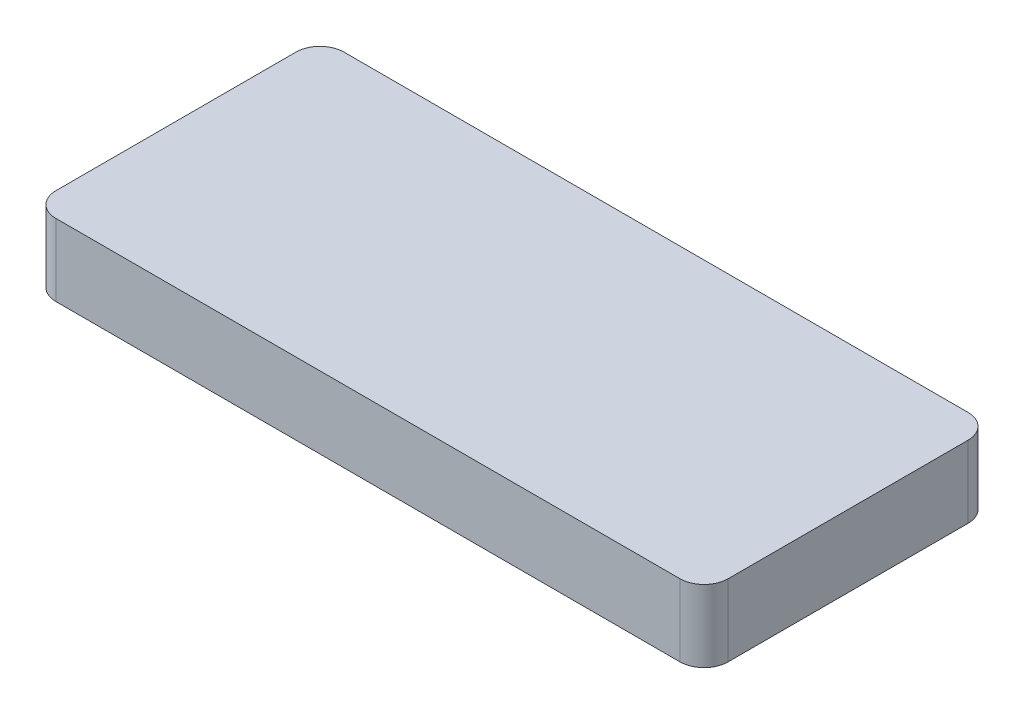
from build123d import *

# Parameters (mm, degrees)
SKETCH1_W           = 140
SKETCH1_H           = 60
BOSS_EXTRUDE1_DEPTH = 15
FILLET1_R           = 5


with BuildPart() as part:
    # Sketch1 → Boss-Extrude1 (new body)
    with BuildSketch(Plane(origin=(0, 0, 0), x_dir=(1, 0, 0), z_dir=(0, 1, 0))):
        Rectangle(SKETCH1_W, SKETCH1_H)
    extrude(amount=BOSS_EXTRUDE1_DEPTH)

    # Fillet1
    fillet1_edges = [part.edges().sort_by_distance(p)[0] for p in [
        (70, 7.5, 30),
        (-70, 7.5, 30),
        (-70, 7.5, -30),
        (70, 7.5, -30),
    ]]
    fillet(fillet1_edges, radius=FILLET1_R)


solid = part.part
